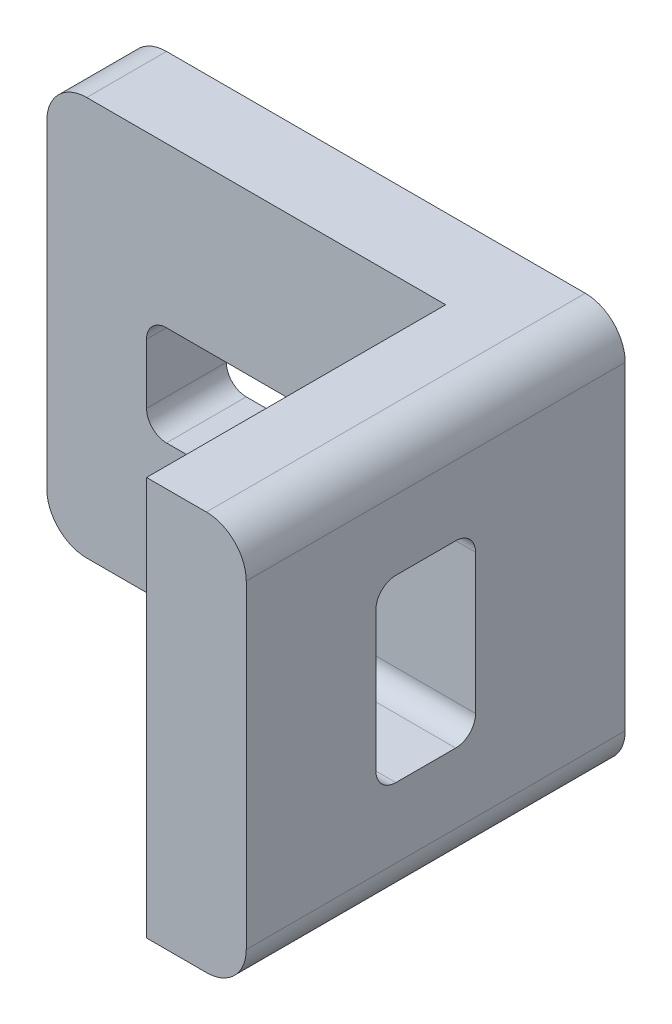
from build123d import *

# Parameters (mm, degrees)
BOSS_EXTRU_1_DEPTH      = 4
BOSS_EXTRU_3_DEPTH      = 15
ENL_V_MAT_EXTRU_1_DEPTH = 50
ENL_V_MAT_EXTRU_2_DEPTH = 50


with BuildPart() as part:
    # Esquisse1 → Boss.-Extru.1 (new body)
    with BuildSketch(Plane.XY):
        with BuildLine():
            Line((-11.273273273, 8.708708709), (9.726726727, 8.708708709))
            ThreePointArc((9.726726727, 8.708708709), (11.140940289, 8.122922271), (11.726726727, 6.708708709))
            Line((11.726726727, 6.708708709), (11.726726727, -9.291291291))
            ThreePointArc((11.726726727, -9.291291291), (11.140940289, -10.705504854), (9.726726727, -11.291291291))
            Line((9.726726727, -11.291291291), (-11.273273273, -11.291291291))
            ThreePointArc((-11.273273273, -11.291291291), (-12.687486836, -10.705504854), (-13.273273273, -9.291291291))
            Line((-13.273273273, -9.291291291), (-13.273273273, 6.708708709))
            ThreePointArc((-13.273273273, 6.708708709), (-12.687486836, 8.122922271), (-11.273273273, 8.708708709))
        make_face()
    extrude(amount=BOSS_EXTRU_1_DEPTH)

    # Esquisse2 → Boss.-Extru.3 (add)
    with BuildSketch(Plane.XY.offset(4)):
        with BuildLine():
            Line((6.726726727, 8.708708709), (9.726726727, 8.708708709))
            ThreePointArc((9.726726727, 8.708708709), (11.140940289, 8.122922271), (11.726726727, 6.708708709))
            Line((11.726726727, 6.708708709), (11.726726727, -9.291291291))
            ThreePointArc((11.726726727, -9.291291291), (11.140940289, -10.705504854), (9.726726727, -11.291291291))
            Line((9.726726727, -11.291291291), (6.726726727, -11.291291291))
            Line((6.726726727, -11.291291291), (6.726726727, 8.708708709))
        make_face()
    extrude(amount=BOSS_EXTRU_3_DEPTH)

    # Esquisse3 → Enlèv. mat.-Extru.1 (cut)
    with BuildSketch(Plane.XY.offset(4)):
        with BuildLine():
            Line((-7.273273273, 0.708708709), (-0.273273273, 0.708708709))
            ThreePointArc((-0.273273273, 0.708708709), (0.433833508, 0.41581549), (0.726726727, -0.291291291))
            Line((0.726726727, -0.291291291), (0.726726727, -3.291291291))
            ThreePointArc((0.726726727, -3.291291291), (0.433833508, -3.998398072), (-0.273273273, -4.291291291))
            Line((-0.273273273, -4.291291291), (-7.273273273, -4.291291291))
            ThreePointArc((-7.273273273, -4.291291291), (-7.980380054, -3.998398072), (-8.273273273, -3.291291291))
            Line((-8.273273273, -3.291291291), (-8.273273273, -0.291291291))
            ThreePointArc((-8.273273273, -0.291291291), (-7.980380054, 0.41581549), (-7.273273273, 0.708708709))
        make_face()
    extrude(amount=-ENL_V_MAT_EXTRU_1_DEPTH, mode=Mode.SUBTRACT)

    # Esquisse4 → Enlèv. mat.-Extru.2 (cut)
    with BuildSketch(Plane.ZY.offset(-6.726726727)):
        with BuildLine():
            Line((8.5, 3.208708709), (11.5, 3.208708709))
            ThreePointArc((11.5, 3.208708709), (12.207106781, 2.91581549), (12.5, 2.208708709))
            Line((12.5, 2.208708709), (12.5, -4.791291291))
            ThreePointArc((12.5, -4.791291291), (12.207106781, -5.498398072), (11.5, -5.791291291))
            Line((11.5, -5.791291291), (8.5, -5.791291291))
            ThreePointArc((8.5, -5.791291291), (7.792893219, -5.498398072), (7.5, -4.791291291))
            Line((7.5, -4.791291291), (7.5, 2.208708709))
            ThreePointArc((7.5, 2.208708709), (7.792893219, 2.91581549), (8.5, 3.208708709))
        make_face()
    extrude(amount=-ENL_V_MAT_EXTRU_2_DEPTH, mode=Mode.SUBTRACT)


solid = part.part
